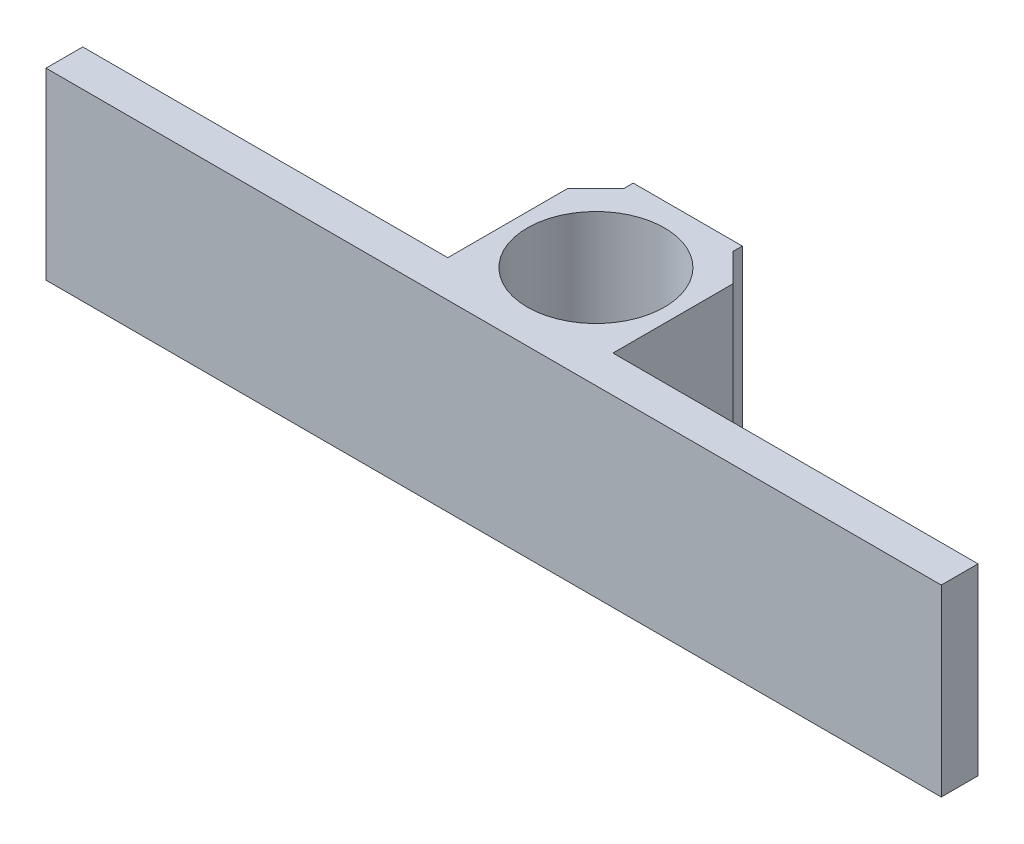
from build123d import *

# Parameters (mm, degrees)
SKETCH1_W                           = 247.65
SKETCH1_H                           = 50.8
BOSS_EXTRUDE1_DEPTH                 = 10.16
CUT_EXTRUDE1_DEPTH                  = 160.914701011
CUT_EXTRUDE1_DEPTH_BACK             = 160.914701011
SKETCH7_R                           = 22.847252038
BOSS_EXTRUDE2_DEPTH                 = 50.8
SKETCH8_R                           = 18.9865
CUT_EXTRUDE2_DEPTH                  = 45.72
SKETCH9_R                           = 7.9375
CUT_EXTRUDE3_DEPTH                  = 164.275821461
BOSS_EXTRUDE3_DEPTH                 = 50.8
BOSS_EXTRUDE4_START                 = -50.8
BOSS_EXTRUDE4_DEPTH                 = 50.8
BOSS_EXTRUDE5_START                 = -50.8
BOSS_EXTRUDE5_DEPTH                 = 50.8
SKETCH22_W                          = 30.1625
SKETCH22_H                          = 50.8
BOSS_EXTRUDE6_DEPTH                 = 2.54
CUT_EXTRUDE4_DEPTH                  = 166.420598915
TAP_DRILL_FOR_1_4_HELICOIL1_REACH   = 172.648
TAP_DRILL_FOR_1_4_HELICOIL1_BORE_R  = 3.3782
CUT_EXTRUDE5_DEPTH                  = 5.55625
CUT_EXTRUDE5_DIRECTION_2_REACH      = 168.46
CUT_EXTRUDE5_DIRECTION_2_END_RADIUS = 18.9865


with BuildPart() as part:
    # Sketch1 → Boss-Extrude1 (new body)
    with BuildSketch(Plane.XY):
        with Locations((-27.465601161, -3.653036721)):
            Rectangle(SKETCH1_W, SKETCH1_H)
    extrude(amount=BOSS_EXTRUDE1_DEPTH)

    # Sketch6 → Cut-Extrude1 (cut, two sides: drawn at the far end of the back side and taken through both)
    with BuildSketch(Plane(origin=(0, 21.746963279, 0), x_dir=(1, 0, 0), z_dir=(0, 1, 0)).offset(-CUT_EXTRUDE1_DEPTH_BACK)):
        with BuildLine():
            Line((211.371578383, 140.927334364), (-20.861601161, 0))
            ThreePointArc((-20.861601161, 0), (-27.465601161, -1.847030056), (-34.069601161, 0))
            Line((-34.069601161, 0), (-266.302780705, 140.927334364))
            Line((-266.302780705, 140.927334364), (-266.302780705, 684.223803161))
            Line((-266.302780705, 684.223803161), (211.371578383, 684.223803161))
            Line((211.371578383, 684.223803161), (211.371578383, 140.927334364))
        make_face()
    extrude(amount=CUT_EXTRUDE1_DEPTH + CUT_EXTRUDE1_DEPTH_BACK, mode=Mode.SUBTRACT)

    # Sketch7 → Boss-Extrude2 (add, through all)
    with BuildSketch(Plane(origin=(0, 21.746963279, 0), x_dir=(1, 0, 0), z_dir=(0, 1, 0))):
        with Locations((-27.464264218, 18.13847077)):
            Circle(SKETCH7_R)
    extrude(amount=-BOSS_EXTRUDE2_DEPTH)

    # Sketch8 → Cut-Extrude2 (cut)
    with BuildSketch(Plane(origin=(0, 21.746963279, 0), x_dir=(1, 0, 0), z_dir=(0, 1, 0))):
        with Locations(Location((-27.464264218, 18.13847077, 0), (0, 0, 270))):
            Circle(SKETCH8_R)
    extrude(amount=-CUT_EXTRUDE2_DEPTH, mode=Mode.SUBTRACT)

    # Sketch9 → Cut-Extrude3 (cut, through all)
    with BuildSketch(Plane(origin=(0, -23.973036721, 0), x_dir=(1, 0, 0), z_dir=(0, 1, 0))):
        with Locations(Location((-27.464264218, 18.13847077, 0), (0, 0, 270))):
            Circle(SKETCH9_R)
    extrude(amount=-CUT_EXTRUDE3_DEPTH, mode=Mode.SUBTRACT)

    # Sketch12 → Boss-Extrude3 (add)
    with BuildSketch(Plane(origin=(0, 21.746963279, 0), x_dir=(1, 0, 0), z_dir=(0, 1, 0))):
        with BuildLine():
            Line((-4.61701218, 18.13847077), (-4.61701218, 0))
            Line((-4.61701218, 0), (-13.572079227, 0))
            ThreePointArc((-13.572079227, 0), (-6.977742093, 8.024157302), (-4.61701218, 18.13847077))
        make_face()
        with BuildLine():
            Line((-50.311516256, 18.13847077), (-50.311516256, 0))
            Line((-50.311516256, 0), (-41.356449209, 0))
            ThreePointArc((-41.356449209, 0), (-47.950786342, 8.024157302), (-50.311516256, 18.13847077))
        make_face()
    extrude(amount=-BOSS_EXTRUDE3_DEPTH)

    # Sketch16 → Boss-Extrude4 (add)
    with BuildSketch(Plane.XZ.offset(29.053036721).offset(BOSS_EXTRUDE4_START)):
        with BuildLine():
            Line((-50.311516256, -18.13847077), (-50.311516256, -40.985722808))
            Line((-50.311516256, -40.985722808), (-27.464264218, -40.985722808))
            ThreePointArc((-27.464264218, -40.985722808), (-43.619711065, -34.293917617), (-50.311516256, -18.13847077))
        make_face()
    extrude(amount=BOSS_EXTRUDE4_DEPTH)

    # Sketch18 → Boss-Extrude5 (add)
    with BuildSketch(Plane.XZ.offset(29.053036721).offset(BOSS_EXTRUDE5_START)):
        with BuildLine():
            Line((-4.61701218, -18.13847077), (-4.61701218, -40.985722808))
            Line((-4.61701218, -40.985722808), (-27.464264218, -40.985722808))
            ThreePointArc((-27.464264218, -40.985722808), (-11.30881737, -34.293917617), (-4.61701218, -18.13847077))
        make_face()
    extrude(amount=BOSS_EXTRUDE5_DEPTH)

    # Sketch22 → Boss-Extrude6 (add)
    with BuildSketch(Plane(origin=(0, 0, -40.985722808), x_dir=(-1, 0, 0), z_dir=(0, 0, -1))):
        with Locations((27.451516256, -3.653036721)):
            Rectangle(SKETCH22_W, SKETCH22_H)
    extrude(amount=BOSS_EXTRUDE6_DEPTH)

    # Sketch23 → Cut-Extrude4 (cut, through all)
    with BuildSketch(Plane(origin=(0, 21.746963279, 0), x_dir=(1, 0, 0), z_dir=(0, 1, 0))):
        Polygon((-42.532766256, 40.985722808), (-50.311516256, 33.206972808), (-50.311516256, 40.985722808), align=None)
        Polygon((-12.370266256, 40.985722808), (-4.61701218, 33.232468732), (-4.61701218, 40.985722808), align=None)
    extrude(amount=-CUT_EXTRUDE4_DEPTH, mode=Mode.SUBTRACT)

    # Tap Drill for 1/4 Helicoil1 bore → Tap Drill for 1/4 Helicoil1 (cut, up to next)
    with BuildSketch(Plane(origin=(14.307728276, 0, -14.307728276), x_dir=(-0.7071067811865561, 0, -0.7071067811865389), z_dir=(0.7071067811865389, 0, -0.7071067811865561)), mode=Mode.PRIVATE) as tap_drill_for_1_4_helicoil1_sk1:
        with Locations((32.224624617, -4.923054714)):
            Circle(TAP_DRILL_FOR_1_4_HELICOIL1_BORE_R)
    tap_drill_for_1_4_helicoil1_tool1 = extrude(tap_drill_for_1_4_helicoil1_sk1.sketch, amount=-TAP_DRILL_FOR_1_4_HELICOIL1_REACH, mode=Mode.PRIVATE) & part.part
    # Tap Drill for 1/4 Helicoil1 bore → Tap Drill for 1/4 Helicoil1 (cut, up to next)
    with BuildSketch(Plane(origin=(14.307728276, 0, -14.307728276), x_dir=(-0.7071067811865561, 0, -0.7071067811865389), z_dir=(0.7071067811865389, 0, -0.7071067811865561)), mode=Mode.PRIVATE) as tap_drill_for_1_4_helicoil1_sk2:
        with Locations((32.24600315, -17.623036721)):
            Circle(TAP_DRILL_FOR_1_4_HELICOIL1_BORE_R)
    tap_drill_for_1_4_helicoil1_tool2 = extrude(tap_drill_for_1_4_helicoil1_sk2.sketch, amount=-TAP_DRILL_FOR_1_4_HELICOIL1_REACH, mode=Mode.PRIVATE) & part.part
    add(tap_drill_for_1_4_helicoil1_tool1.solids().sort_by_distance((-8.478522, -4.923055, -37.093979))[0], mode=Mode.SUBTRACT)
    add(tap_drill_for_1_4_helicoil1_tool2.solids().sort_by_distance((-8.493639, -17.623037, -37.109096))[0], mode=Mode.SUBTRACT)

    # Sketch28 → Cut-Extrude5 (cut)
    with BuildSketch(Plane(origin=(8.919574603, 0, -8.919574603), x_dir=(-0.7071067811865561, 0, -0.7071067811865389), z_dir=(0.7071067811865389, 0, -0.7071067811865561))):
        Polygon((28.946446362, -23.338036721), (35.545559939, -23.338036721), (38.845116727, -17.623036721), (35.545559939, -11.908036721), (28.946446362, -11.908036721), (25.646889574, -17.623036721), align=None)
        Polygon((38.823738194, -4.923054714), (35.524181405, 0.791945286), (28.925067829, 0.791945286), (25.62551104, -4.923054714), (28.925067829, -10.638054714), (35.524181405, -10.638054714), align=None)
    extrude(amount=CUT_EXTRUDE5_DEPTH, mode=Mode.SUBTRACT)

    # Cut-Extrude5 direction 2: up to this cylinder (the profile starts outside it)
    cut_extrude5_direction_2_end = Plane(origin=(-27.464264218, -11.273046, -18.13847077), z_dir=(0, 1, 0)) * Cylinder(CUT_EXTRUDE5_DIRECTION_2_END_RADIUS, 388.592982, mode=Mode.PRIVATE)
    # Sketch28 → Cut-Extrude5 direction 2 (cut, up to the surface)
    with BuildSketch(Plane(origin=(8.919574603, 0, -8.919574603), x_dir=(-0.7071067811865561, 0, -0.7071067811865389), z_dir=(0.7071067811865389, 0, -0.7071067811865561)), mode=Mode.PRIVATE) as cut_extrude5_direction_2_sk1:
        Polygon((28.946446362, -23.338036721), (35.545559939, -23.338036721), (38.845116727, -17.623036721), (35.545559939, -11.908036721), (28.946446362, -11.908036721), (25.646889574, -17.623036721), align=None)
    cut_extrude5_direction_2_tool1 = extrude(cut_extrude5_direction_2_sk1.sketch, amount=-CUT_EXTRUDE5_DIRECTION_2_REACH, mode=Mode.PRIVATE) - cut_extrude5_direction_2_end
    add(cut_extrude5_direction_2_tool1.solids().sort_by_distance((-13.881793, -17.623037, -31.720942))[0], mode=Mode.SUBTRACT)
    # Sketch28 → Cut-Extrude5 direction 2 (cut, up to the surface)
    with BuildSketch(Plane(origin=(8.919574603, 0, -8.919574603), x_dir=(-0.7071067811865561, 0, -0.7071067811865389), z_dir=(0.7071067811865389, 0, -0.7071067811865561)), mode=Mode.PRIVATE) as cut_extrude5_direction_2_sk2:
        Polygon((38.823738194, -4.923054714), (35.524181405, 0.791945286), (28.925067829, 0.791945286), (25.62551104, -4.923054714), (28.925067829, -10.638054714), (35.524181405, -10.638054714), align=None)
    cut_extrude5_direction_2_tool2 = extrude(cut_extrude5_direction_2_sk2.sketch, amount=-CUT_EXTRUDE5_DIRECTION_2_REACH, mode=Mode.PRIVATE) - cut_extrude5_direction_2_end
    add(cut_extrude5_direction_2_tool2.solids().sort_by_distance((-13.866676, -4.923055, -31.705825))[0], mode=Mode.SUBTRACT)


solid = part.part
